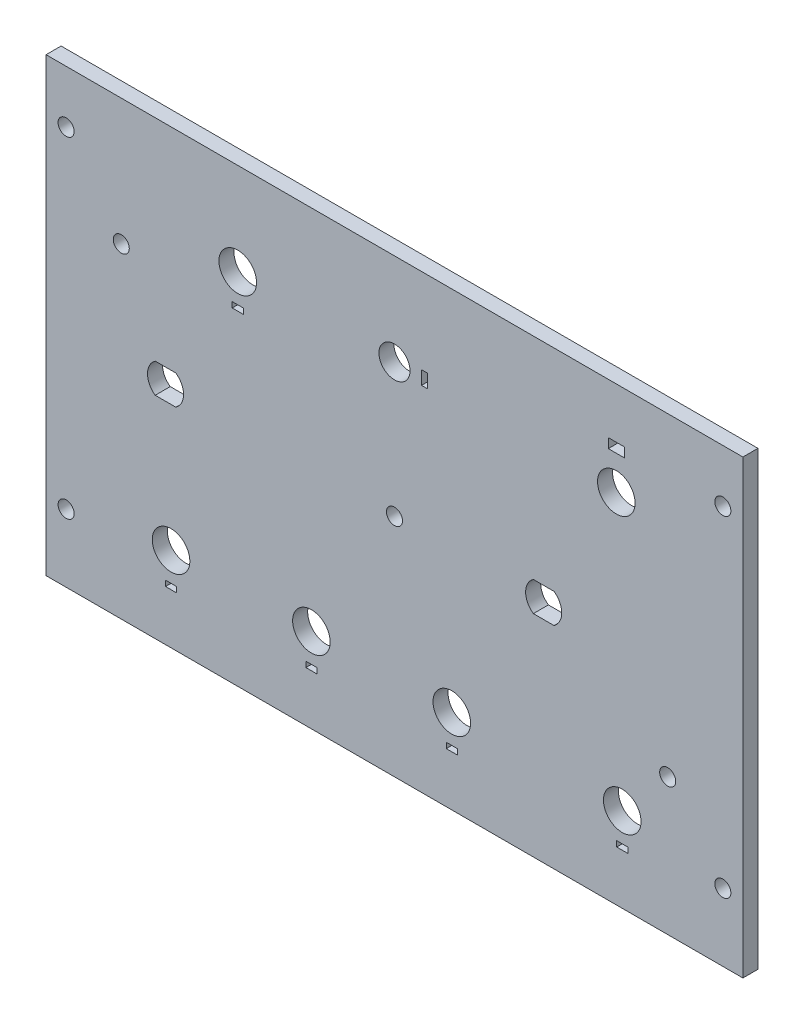
from build123d import *

# Parameters (mm, degrees)
SKETCH1_W           = 139
SKETCH1_H           = 90
SKETCH1_R           = 1.6
SKETCH1_R_2         = 3.75
SKETCH1_R_3         = 3.1
SKETCH1_W_2         = 2.2
SKETCH1_H_2         = 1.1
SKETCH1_W_3         = 1.2
SKETCH1_H_3         = 2.7
SKETCH1_W_4         = 3.2
SKETCH1_H_4         = 1.9
BOSS_EXTRUDE1_DEPTH = 3


with BuildPart() as part:
    # Sketch1 → Boss-Extrude1 (new body)
    with BuildSketch(Plane.XY):
        with Locations((69.5, 45)):
            Rectangle(SKETCH1_W, SKETCH1_H)
        with Locations((4, 79.5)):
            Circle(SKETCH1_R, mode=Mode.SUBTRACT)
        with Locations((135, 79.5)):
            Circle(SKETCH1_R, mode=Mode.SUBTRACT)
        with Locations((135, 13.5)):
            Circle(SKETCH1_R, mode=Mode.SUBTRACT)
        with Locations((4, 13.5)):
            Circle(SKETCH1_R, mode=Mode.SUBTRACT)
        with Locations((15, 64.814177958)):
            Circle(SKETCH1_R, mode=Mode.SUBTRACT)
        with Locations((38.235051241, 71.614177958)):
            Circle(SKETCH1_R_2, mode=Mode.SUBTRACT)
        with Locations((124, 27.251424775)):
            Circle(SKETCH1_R, mode=Mode.SUBTRACT)
        with Locations((24.931997534, 16.841976033)):
            Circle(SKETCH1_R_2, mode=Mode.SUBTRACT)
        with Locations((52.931997534, 16.841976033)):
            Circle(SKETCH1_R_2, mode=Mode.SUBTRACT)
        with Locations((80.931997534, 16.841976033)):
            Circle(SKETCH1_R_2, mode=Mode.SUBTRACT)
        with Locations((114.931997534, 16.841976033)):
            Circle(SKETCH1_R_2, mode=Mode.SUBTRACT)
        with Locations((69.5, 71.675460618)):
            Circle(SKETCH1_R_3, mode=Mode.SUBTRACT)
        with Locations((113.751643049, 71.275460618)):
            Circle(SKETCH1_R_2, mode=Mode.SUBTRACT)
        with Locations((69.5, 45)):
            Circle(SKETCH1_R, mode=Mode.SUBTRACT)
        with Locations((38.235051241, 65.364177958)):
            Rectangle(SKETCH1_W_2, SKETCH1_H_2, mode=Mode.SUBTRACT)
        with Locations((24.931997534, 10.591976033)):
            Rectangle(SKETCH1_W_2, SKETCH1_H_2, mode=Mode.SUBTRACT)
        with Locations((52.931997534, 10.591976033)):
            Rectangle(SKETCH1_W_2, SKETCH1_H_2, mode=Mode.SUBTRACT)
        with Locations((80.931997534, 10.591976033)):
            Rectangle(SKETCH1_W_2, SKETCH1_H_2, mode=Mode.SUBTRACT)
        with Locations((114.931997534, 10.591976033)):
            Rectangle(SKETCH1_W_2, SKETCH1_H_2, mode=Mode.SUBTRACT)
        with BuildLine():
            Line((97.198408737, 42.05), (101.325150794, 42.05))
            ThreePointArc((101.325150794, 42.05), (102.861779766, 45), (101.325150794, 47.95))
            Line((101.325150794, 47.95), (97.198408737, 47.95))
            ThreePointArc((97.198408737, 47.95), (95.661779766, 45), (97.198408737, 42.05))
        make_face(mode=Mode.SUBTRACT)
        with Locations((75.5, 71.675460618)):
            Rectangle(SKETCH1_W_3, SKETCH1_H_3, mode=Mode.SUBTRACT)
        with Locations((113.751643049, 78.975460618)):
            Rectangle(SKETCH1_W_4, SKETCH1_H_4, mode=Mode.SUBTRACT)
        with BuildLine():
            Line((21.768626506, 42.05), (25.895368563, 42.05))
            ThreePointArc((25.895368563, 42.05), (27.431997534, 45), (25.895368563, 47.95))
            Line((25.895368563, 47.95), (21.768626506, 47.95))
            ThreePointArc((21.768626506, 47.95), (20.231997534, 45), (21.768626506, 42.05))
        make_face(mode=Mode.SUBTRACT)
    extrude(amount=BOSS_EXTRUDE1_DEPTH)


solid = part.part
